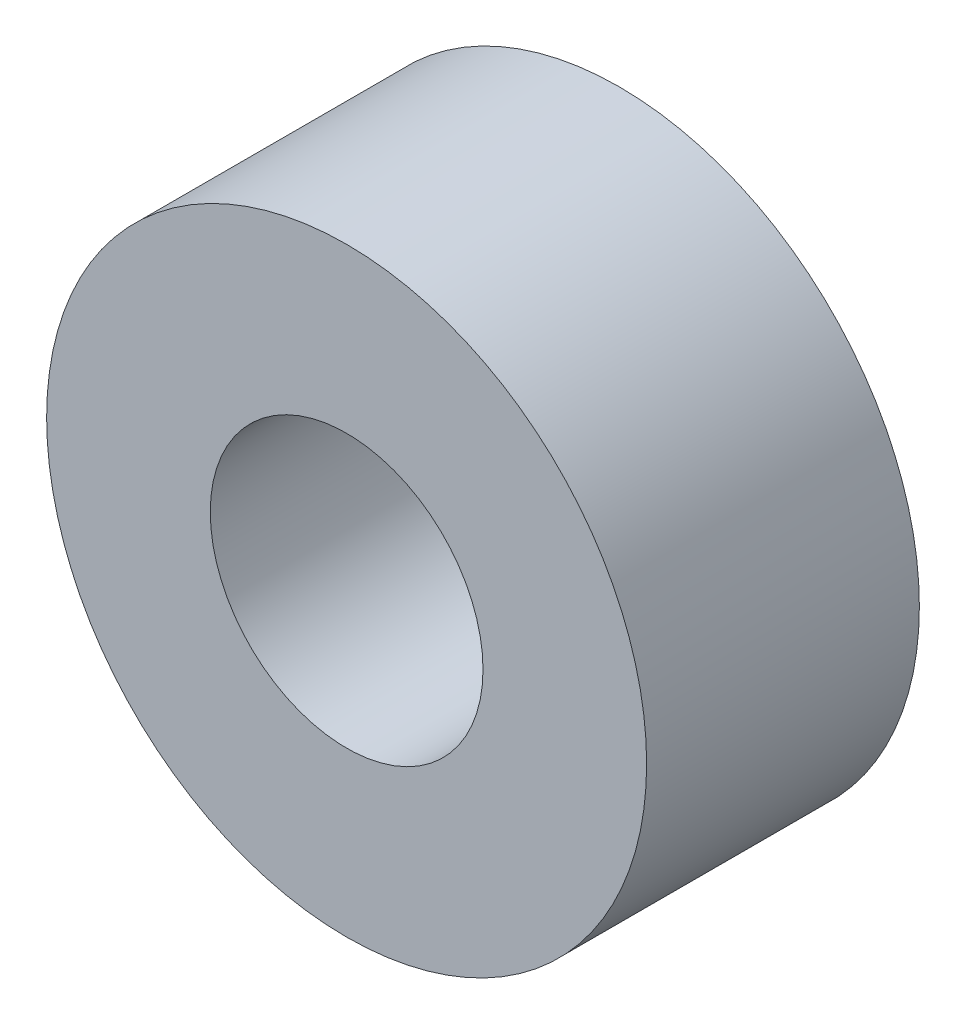
from build123d import *

# Parameters (mm, degrees)
ESBO_O1_R                = 5.5
ESBO_O1_R_2              = 2.5
RESSALTO_EXTRUS_O1_DEPTH = 5


with BuildPart() as part:
    # Esboço1 → Ressalto-extrusão1 (new body)
    with BuildSketch(Plane.XY):
        Circle(ESBO_O1_R)
        Circle(ESBO_O1_R_2, mode=Mode.SUBTRACT)
    extrude(amount=RESSALTO_EXTRUS_O1_DEPTH)


solid = part.part
